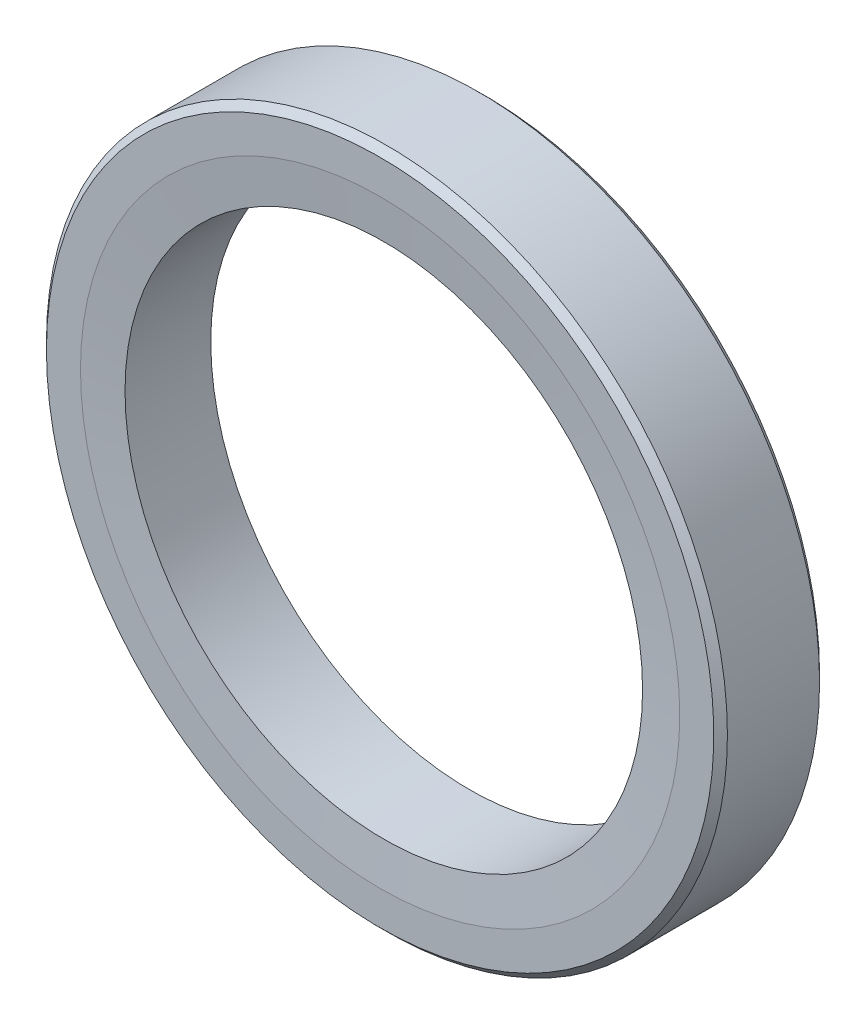
from build123d import *

# Parameters (mm, degrees)
CHAMFER1_SIZE = 0.5


with BuildPart() as part:
    # Sketch1 → Revolve1 (revolve)
    with BuildSketch(Plane(origin=(0, 0, 0), x_dir=(0, 0, -1), z_dir=(1, 0, 0)), mode=Mode.PRIVATE) as revolve1_sk:
        Polygon((-3.88315, 25), (3.88315, 25), (3.88315, 22), (2.682605307, 19), (-3.612740697, 19), (-3.88315, 22), align=None)
    revolve(revolve1_sk.sketch.rotate(Axis((0, 0, 4.95), (0, 0, -1)), 90), axis=Axis((0, 0, 4.95), (0, 0, -1)))

    # Chamfer1
    chamfer1_edges = [part.edges().sort_by_distance(p)[0] for p in [
        (-25, 0, 3.88315),
        (-25, 0, -3.88315),
    ]]
    chamfer(chamfer1_edges, length=CHAMFER1_SIZE)


solid = part.part
